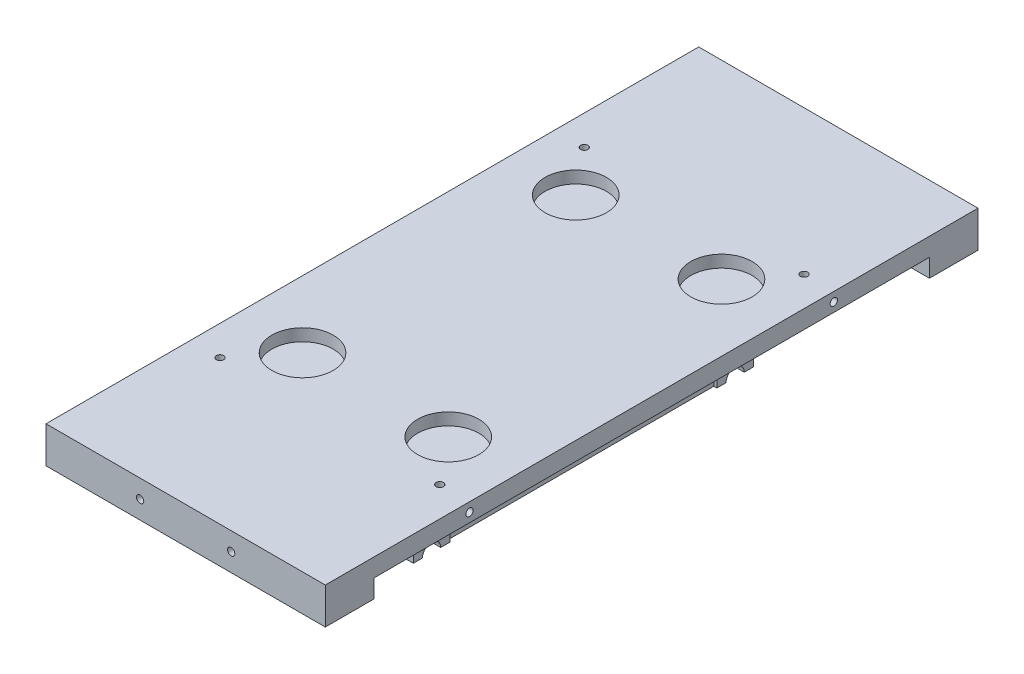
from build123d import *

# Parameters (mm, degrees)
SKETCH_4_W           = 46
SKETCH_4_H           = 107.5
EXTRUDE_1_DEPTH      = 3
SKETCH_5_W           = 23.5
SKETCH_5_H           = 56
EXTRUDE_2_DEPTH      = 12.4
SKETCH_6_R           = 0.75
CUT_EXTRUDE_1_DEPTH  = 66.1949768
SKETCH_6_5_R         = 1.5
CUT_EXTRUDE_4_DEPTH  = 1.2
CUT_EXTRUDE_START    = -22.3
SKETCH_6_6_R         = 1.5
CUT_EXTRUDE_5_DEPTH  = 1.2
SKETCH_7_R           = 0.7
CUT_EXTRUDE_6_DEPTH  = 2
SKETCH_9_W           = 46
SKETCH_9_H           = 8
EXTRUDE_3_DEPTH      = 3
SKETCH_10_R          = 0.6
CUT_EXTRUDE_8_DEPTH  = 2
CUT_EXTRUDE_START_2  = -105.5
SKETCH_10_2_R        = 0.6
CUT_EXTRUDE_9_DEPTH  = 2
SKETCH_11_R          = 0.6
CUT_EXTRUDE_10_DEPTH = 2
SKETCH_12_W          = 44
SKETCH_12_H          = 12.4
CUT_EXTRUDE_11_DEPTH = 0.5
CUT_EXTRUDE_START_3  = -23.5
SKETCH_12_2_W        = 44
SKETCH_12_2_H        = 12.4
CUT_EXTRUDE_12_DEPTH = 0.5
SKETCH_13_R          = 0.6
CUT_EXTRUDE_13_DEPTH = 2
CUT_EXTRUDE_START_4  = -44
SKETCH_13_2_R        = 0.6
CUT_EXTRUDE_14_DEPTH = 2
SKETCH_14_R          = 5.05
CUT_EXTRUDE_15_DEPTH = 2


with BuildPart() as part:
    # 草图4 → 凸台-拉伸1 (new body)
    with BuildSketch(Plane(origin=(0, 0, 0), x_dir=(1, 0, 0), z_dir=(0, 1, 0))):
        Rectangle(SKETCH_4_W, SKETCH_4_H)
    extrude(amount=EXTRUDE_1_DEPTH)

    # 草图5 → 凸台-拉伸2 (add)
    with BuildSketch(Plane.XZ):
        Rectangle(SKETCH_5_W, SKETCH_5_H)
    extrude(amount=EXTRUDE_2_DEPTH)

    # 草图6 → 切除-拉伸1 (cut, through all)
    with BuildSketch(Plane.ZY.offset(11.75)):
        with Locations((25, -12.4)):
            Circle(SKETCH_6_R)
        with Locations((-25, -12.4)):
            Circle(SKETCH_6_R)
    extrude(amount=-CUT_EXTRUDE_1_DEPTH, mode=Mode.SUBTRACT)

    # 草图6<5> → 切除-拉伸4 (cut)
    with BuildSketch(Plane.ZY.offset(11.75)):
        with Locations((25, -12.4)):
            Circle(SKETCH_6_5_R)
        with Locations((-25, -12.4)):
            Circle(SKETCH_6_5_R)
    extrude(amount=-CUT_EXTRUDE_4_DEPTH, mode=Mode.SUBTRACT)

    # 草图6<6> → 切除-拉伸5 (cut)
    with BuildSketch(Plane.ZY.offset(11.75).offset(CUT_EXTRUDE_START)):
        with Locations((25, -12.4)):
            Circle(SKETCH_6_6_R)
        with Locations((-25, -12.4)):
            Circle(SKETCH_6_6_R)
    extrude(amount=-CUT_EXTRUDE_5_DEPTH, mode=Mode.SUBTRACT)

    # 草图7 → 切除-拉伸6 (cut)
    with BuildSketch(Plane(origin=(0, -12.4, 0), x_dir=(-1, 0, 0), z_dir=(0, -1, 0))):
        with Locations(Location((9.249949764, -20, 0), (0, 0, 90))):
            Circle(SKETCH_7_R)
        with Locations(Location((-9.249949764, -20, 0), (0, 0, 90))):
            Circle(SKETCH_7_R)
        with Locations(Location((-9.249949764, -6, 0), (0, 0, 90))):
            Circle(SKETCH_7_R)
        with Locations(Location((9.249949764, -6, 0), (0, 0, 90))):
            Circle(SKETCH_7_R)
        with Locations(Location((9.249949764, 6, 0), (0, 0, 90))):
            Circle(SKETCH_7_R)
        with Locations(Location((-9.249949764, 6, 0), (0, 0, 90))):
            Circle(SKETCH_7_R)
        with Locations(Location((-9.249949764, 20, 0), (0, 0, 90))):
            Circle(SKETCH_7_R)
        with Locations(Location((9.249949764, 20, 0), (0, 0, 90))):
            Circle(SKETCH_7_R)
    extrude(amount=-CUT_EXTRUDE_6_DEPTH, mode=Mode.SUBTRACT)

    # 草图9 → 凸台-拉伸3 (add)
    with BuildSketch(Plane.XZ):
        with Locations((0, 49.75)):
            Rectangle(SKETCH_9_W, SKETCH_9_H)
        with Locations((0, -49.75)):
            Rectangle(SKETCH_9_W, SKETCH_9_H)
    extrude(amount=EXTRUDE_3_DEPTH)

    # 草图10 → 切除-拉伸8 (cut)
    with BuildSketch(Plane.XY.offset(53.75)):
        with Locations((-7.5, 0)):
            Circle(SKETCH_10_R)
        with Locations((7.5, 0)):
            Circle(SKETCH_10_R)
    extrude(amount=-CUT_EXTRUDE_8_DEPTH, mode=Mode.SUBTRACT)

    # 草图10<2> → 切除-拉伸9 (cut)
    with BuildSketch(Plane.XY.offset(53.75).offset(CUT_EXTRUDE_START_2)):
        with Locations((-7.5, 0)):
            Circle(SKETCH_10_2_R)
        with Locations((7.5, 0)):
            Circle(SKETCH_10_2_R)
    extrude(amount=-CUT_EXTRUDE_9_DEPTH, mode=Mode.SUBTRACT)

    # 草图11 → 切除-拉伸10 (cut)
    with BuildSketch(Plane(origin=(0, 3, 0), x_dir=(1, 0, 0), z_dir=(0, 1, 0))):
        with Locations(Location((-18.1, 30, 0), (0, 0, 270))):
            Circle(SKETCH_11_R)
        with Locations(Location((18.1, 30, 0), (0, 0, 270))):
            Circle(SKETCH_11_R)
        with Locations(Location((18.1, -30, 0), (0, 0, 270))):
            Circle(SKETCH_11_R)
        with Locations(Location((-18.1, -30, 0), (0, 0, 270))):
            Circle(SKETCH_11_R)
    extrude(amount=-CUT_EXTRUDE_10_DEPTH, mode=Mode.SUBTRACT)

    # 草图12 → 切除-拉伸11 (cut)
    with BuildSketch(Plane.ZY.offset(11.75)):
        with Locations((0, -6.2)):
            Rectangle(SKETCH_12_W, SKETCH_12_H)
    extrude(amount=-CUT_EXTRUDE_11_DEPTH, mode=Mode.SUBTRACT)

    # 草图12<2> → 切除-拉伸12 (cut)
    with BuildSketch(Plane.ZY.offset(11.75).offset(CUT_EXTRUDE_START_3)):
        with Locations((0, -6.2)):
            Rectangle(SKETCH_12_2_W, SKETCH_12_2_H)
    extrude(amount=CUT_EXTRUDE_12_DEPTH, mode=Mode.SUBTRACT)

    # 草图13 → 切除-拉伸13 (cut)
    with BuildSketch(Plane(origin=(23, 0, 0), x_dir=(0, 0, -1), z_dir=(1, 0, 0))):
        with Locations((-30, 1.5)):
            Circle(SKETCH_13_R)
        with Locations((30, 1.5)):
            Circle(SKETCH_13_R)
    extrude(amount=-CUT_EXTRUDE_13_DEPTH, mode=Mode.SUBTRACT)

    # 草图13<2> → 切除-拉伸14 (cut)
    with BuildSketch(Plane(origin=(23, 0, 0), x_dir=(0, 0, -1), z_dir=(1, 0, 0)).offset(CUT_EXTRUDE_START_4)):
        with Locations((-30, 1.5)):
            Circle(SKETCH_13_2_R)
        with Locations((30, 1.5)):
            Circle(SKETCH_13_2_R)
    extrude(amount=-CUT_EXTRUDE_14_DEPTH, mode=Mode.SUBTRACT)

    # 草图14 → 切除-拉伸15 (cut)
    with BuildSketch(Plane(origin=(0, 3, 0), x_dir=(1, 0, 0), z_dir=(0, 1, 0))):
        with Locations(Location((-12, 22.5, 0), (0, 0, 270))):
            Circle(SKETCH_14_R)
        with Locations(Location((12, 22.5, 0), (0, 0, 270))):
            Circle(SKETCH_14_R)
        with Locations(Location((-12, -22.5, 0), (0, 0, 270))):
            Circle(SKETCH_14_R)
        with Locations(Location((12, -22.5, 0), (0, 0, 270))):
            Circle(SKETCH_14_R)
    extrude(amount=-CUT_EXTRUDE_15_DEPTH, mode=Mode.SUBTRACT)


solid = part.part
